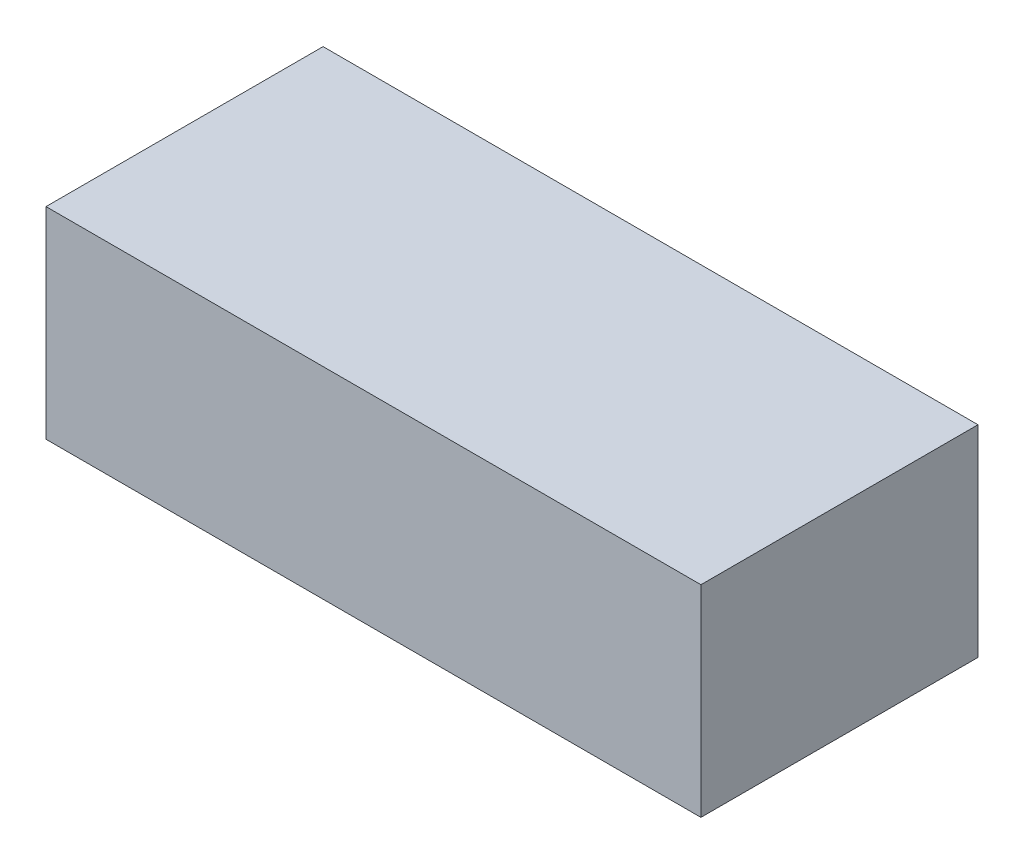
from build123d import *

# Parameters (mm, degrees)
SKETCH1_W           = 78
SKETCH1_H           = 33
BOSS_EXTRUDE1_DEPTH = 24


with BuildPart() as part:
    # Sketch1 → Boss-Extrude1 (new body)
    with BuildSketch(Plane(origin=(0, 0, 0), x_dir=(1, 0, 0), z_dir=(0, 1, 0))):
        with Locations((39, 16.5)):
            Rectangle(SKETCH1_W, SKETCH1_H)
    extrude(amount=BOSS_EXTRUDE1_DEPTH)


solid = part.part
